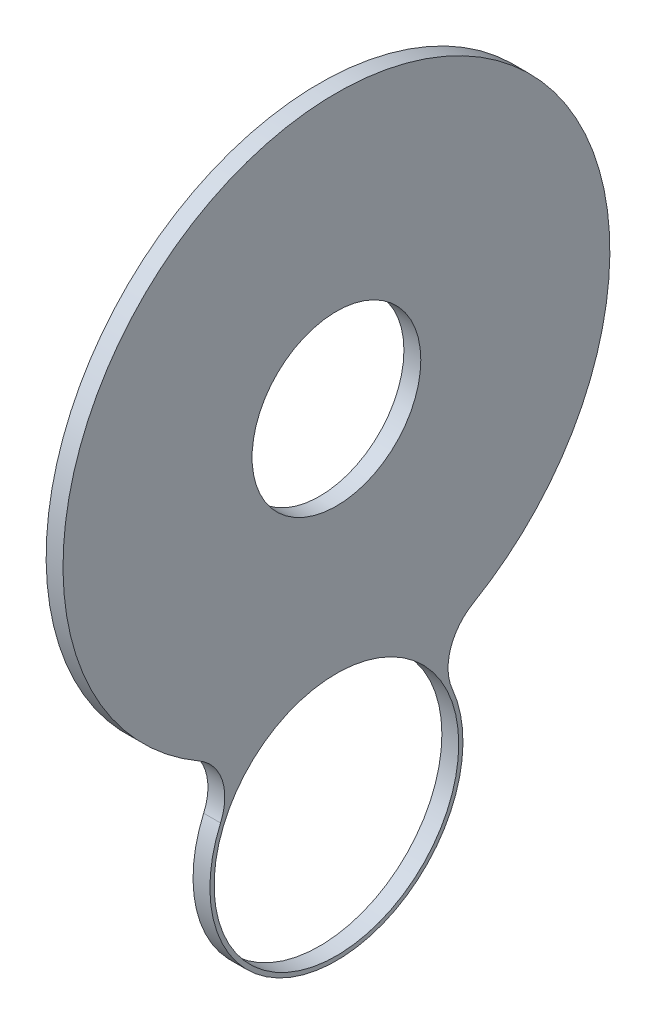
from build123d import *

# Parameters (mm, degrees)
SKETCH1_R           = 50
BOSS_EXTRUDE1_DEPTH = 10
SKETCH2_R           = 72.5
CUT_EXTRUDE1_DEPTH  = 352.523431325


with BuildPart() as part:
    # Sketch1 → Boss-Extrude1 (new body)
    with BuildSketch(Plane(origin=(0, 0, 0), x_dir=(0, 0, -1), z_dir=(1, 0, 0))):
        with BuildLine():
            ThreePointArc((81.153066922, 9.411970763), (0, 311.772037013), (-81.153066922, 9.411970763))
            ThreePointArc((-81.153066922, 9.411970763), (-67.666963002, -7.212746854), (-68.696324701, -28.59490412))
            ThreePointArc((-68.696324701, -28.59490412), (0, -133.691664287), (68.696324701, -28.59490412))
            ThreePointArc((68.696324701, -28.59490412), (67.666963002, -7.212746854), (81.153066922, 9.411970763))
        make_face()
        with Locations((0, 149.701312613)):
            Circle(SKETCH1_R, mode=Mode.SUBTRACT)
    extrude(amount=BOSS_EXTRUDE1_DEPTH)

    # Sketch2 → Cut-Extrude1 (cut, through all)
    with BuildSketch(Plane(origin=(10, 0, 0), x_dir=(0, 0, -1), z_dir=(1, 0, 0))):
        with Locations((0, -58.691664287)):
            Circle(SKETCH2_R)
    extrude(amount=-CUT_EXTRUDE1_DEPTH, mode=Mode.SUBTRACT)


solid = part.part
